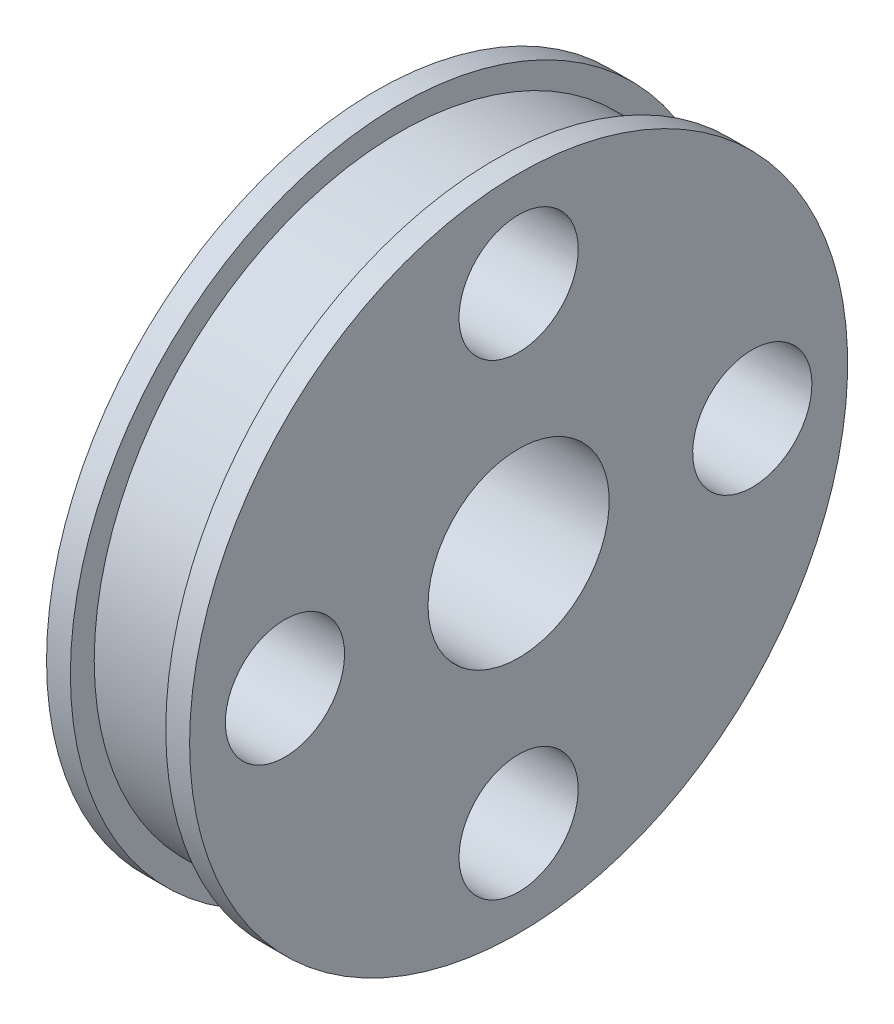
from build123d import *

# Parameters (mm, degrees)
SKETCH2_R          = 12.5
CUT_EXTRUDE1_DEPTH = 116.779963724
CIRPATTERN1_COUNT  = 4


with BuildPart() as part:
    # Sketch1 → Revolve1 (revolve)
    with BuildSketch(Plane.XY, mode=Mode.PRIVATE) as revolve1_sk:
        Polygon((0, 0), (30, 0), (30, 50), (25, 50), (25, 45), (5, 45), (5, 50), (0, 50), align=None)
    revolve(revolve1_sk.sketch.rotate(Axis((-128.92900602, -19, 0), (1, 0, 0)), 90), axis=Axis((-128.92900602, -19, 0), (1, 0, 0)))

    # Sketch2 → Cut-Extrude1 (cut, through all)
    with BuildSketch(Plane(origin=(30, 0, 0), x_dir=(0, 0, -1), z_dir=(1, 0, 0))):
        with Locations((0, 30)):
            Circle(SKETCH2_R)
    cut_extrude1 = extrude(amount=-CUT_EXTRUDE1_DEPTH, mode=Mode.SUBTRACT)

    # CirPattern1: Cut-Extrude1 ×4 about axis
    cirpattern1_axis = Axis((0, -19, 0), (1, 0, 0))
    for i in range(1, CIRPATTERN1_COUNT):
        add(cut_extrude1.rotate(cirpattern1_axis, i * 360 / CIRPATTERN1_COUNT), mode=Mode.SUBTRACT)


solid = part.part
